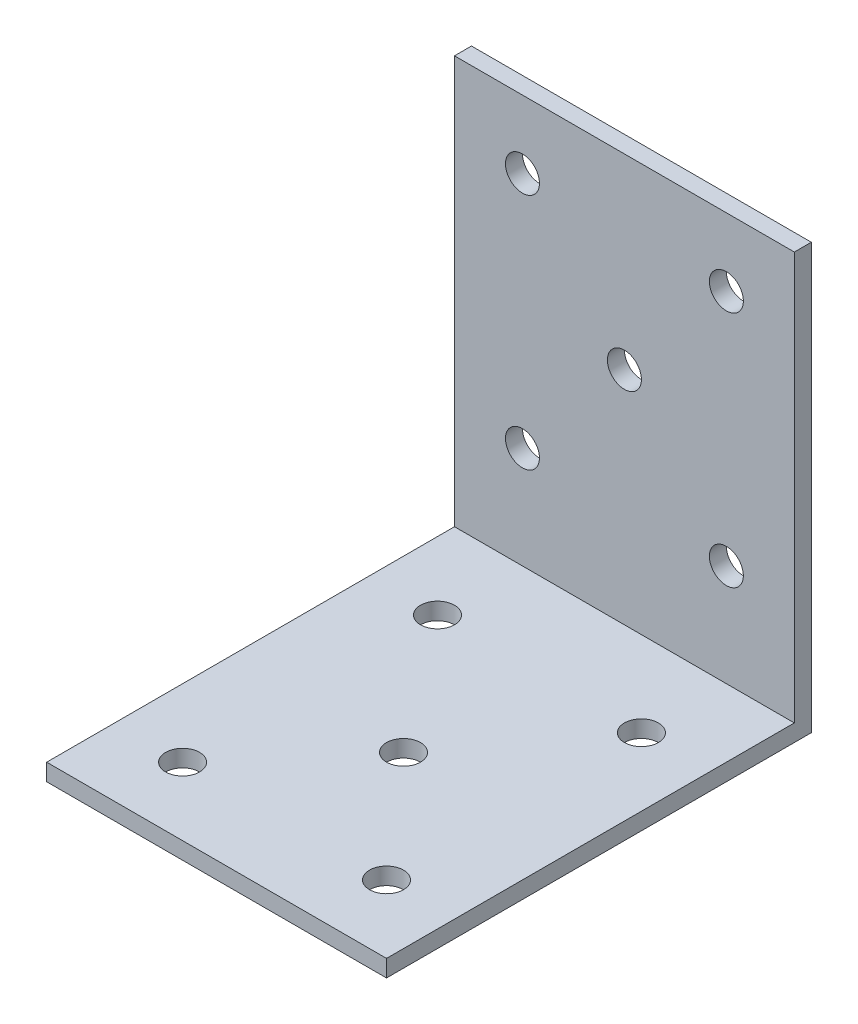
from build123d import *

# Parameters (mm, degrees)
ESQUISSE1_W        = 40
ESQUISSE1_H        = 50
ESQUISSE1_R        = 2
BOSS_EXTRU_1_DEPTH = 2
ESQUISSE4_W        = 40
ESQUISSE4_H        = 50
ESQUISSE4_R        = 2
BOSS_EXTRU_3_DEPTH = 2


with BuildPart() as part:
    # Esquisse1 → Boss.-Extru.1 (new body)
    with BuildSketch(Plane(origin=(0, 0, 0), x_dir=(1, 0, 0), z_dir=(0, 1, 0))):
        with Locations((0, 3)):
            Rectangle(ESQUISSE1_W, ESQUISSE1_H)
        with Locations(Location((0, 0, 0), (0, 0, 270))):
            Circle(ESQUISSE1_R, mode=Mode.SUBTRACT)
        with Locations(Location((-12, -14, 0), (0, 0, 270))):
            Circle(ESQUISSE1_R, mode=Mode.SUBTRACT)
        with Locations(Location((-12, 16, 0), (0, 0, 270))):
            Circle(ESQUISSE1_R, mode=Mode.SUBTRACT)
        with Locations(Location((12, 16, 0), (0, 0, 270))):
            Circle(ESQUISSE1_R, mode=Mode.SUBTRACT)
        with Locations(Location((12, -14, 0), (0, 0, 270))):
            Circle(ESQUISSE1_R, mode=Mode.SUBTRACT)
    extrude(amount=BOSS_EXTRU_1_DEPTH)

    # Esquisse4 → Boss.-Extru.3 (add)
    with BuildSketch(Plane(origin=(0, 0, -28), x_dir=(-1, 0, 0), z_dir=(0, 0, -1))):
        with Locations((0, 25)):
            Rectangle(ESQUISSE4_W, ESQUISSE4_H)
        with Locations((0, 28)):
            Circle(ESQUISSE4_R, mode=Mode.SUBTRACT)
        with Locations((12, 42)):
            Circle(ESQUISSE4_R, mode=Mode.SUBTRACT)
        with Locations((-12, 42)):
            Circle(ESQUISSE4_R, mode=Mode.SUBTRACT)
        with Locations((-12, 14)):
            Circle(ESQUISSE4_R, mode=Mode.SUBTRACT)
        with Locations((12, 14)):
            Circle(ESQUISSE4_R, mode=Mode.SUBTRACT)
    extrude(amount=-BOSS_EXTRU_3_DEPTH)


solid = part.part
